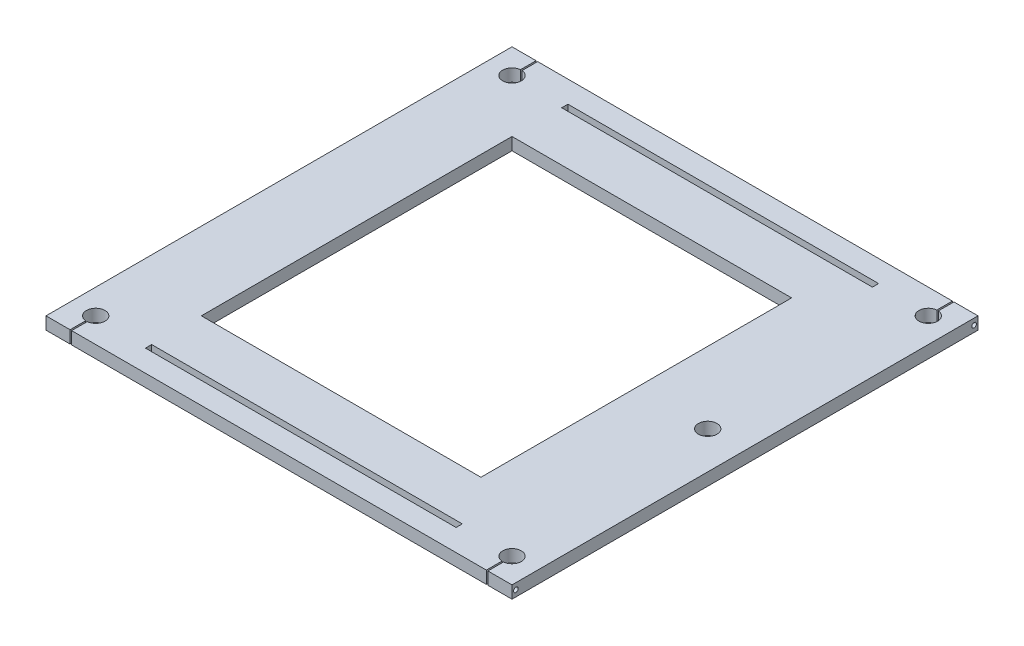
from build123d import *

# Parameters (mm, degrees)
SKETCH1_W               = 300
SKETCH1_H               = 300
SKETCH1_W_2             = 180
SKETCH1_H_2             = 200
BOSS_EXTRUDE1_DEPTH     = 8
CUT_EXTRUDE1_DEPTH      = 213.282830205
SKETCH3_R               = 1.5
CUT_EXTRUDE2_DEPTH      = 16.5
SKETCH4_R               = 6
CUT_EXTRUDE4_DEPTH      = 213.282830205
MIRROR4_COPY_1_DEPTH    = 213.282830205
MIRROR4_COPY_2_SKETCH_R = 1.5
MIRROR4_COPY_2_DEPTH    = 16.5
SKETCH5_W               = 200
SKETCH5_H               = 4
CUT_EXTRUDE5_DEPTH      = 213.282830205


with BuildPart() as part:
    # Sketch1 → Boss-Extrude1 (new body)
    with BuildSketch(Plane(origin=(0, 0, 0), x_dir=(1, 0, 0), z_dir=(0, 1, 0))):
        Rectangle(SKETCH1_W, SKETCH1_H)
        with Locations((-10, 0)):
            Rectangle(SKETCH1_W_2, SKETCH1_H_2, mode=Mode.SUBTRACT)
    extrude(amount=BOSS_EXTRUDE1_DEPTH)

    # Sketch2 → Cut-Extrude1 (cut, through all)
    with BuildSketch(Plane(origin=(0, 0, 0), x_dir=(1, 0, 0), z_dir=(0, 1, 0))):
        with BuildLine():
            Line((133.5, 150), (134.5, 150))
            Line((134.5, 150), (134.5, 139.979130372))
            ThreePointArc((134.5, 139.979130372), (134, 128), (133.5, 139.979130372))
            Line((133.5, 139.979130372), (133.5, 150))
        make_face()
    cut_extrude1 = extrude(amount=CUT_EXTRUDE1_DEPTH, mode=Mode.SUBTRACT)

    # Sketch3 → Cut-Extrude2 (cut)
    with BuildSketch(Plane(origin=(150, 0, 0), x_dir=(0, 0, -1), z_dir=(1, 0, 0))):
        with Locations((147.5, 4)):
            Circle(SKETCH3_R)
    cut_extrude2 = extrude(amount=-CUT_EXTRUDE2_DEPTH, mode=Mode.SUBTRACT)

    # Mirror3: Cut-Extrude1, Cut-Extrude2 across plane
    add(cut_extrude1.mirror(Plane.XY), mode=Mode.SUBTRACT)
    add(cut_extrude2.mirror(Plane.XY), mode=Mode.SUBTRACT)

    # Sketch4 → Cut-Extrude4 (cut, through all)
    with BuildSketch(Plane(origin=(0, 0, 0), x_dir=(1, 0, 0), z_dir=(0, 1, 0))):
        with Locations(Location((126, 0, 0), (0, 0, 270))):
            Circle(SKETCH4_R)
    extrude(amount=CUT_EXTRUDE4_DEPTH, mode=Mode.SUBTRACT)

    # Mirror4: Cut-Extrude1, Cut-Extrude2 across plane
    add(cut_extrude1.mirror(Plane(origin=(0, 0, 0), x_dir=(0, 0, 1), z_dir=(1, 0, 0))), mode=Mode.SUBTRACT)
    add(cut_extrude2.mirror(Plane(origin=(0, 0, 0), x_dir=(0, 0, 1), z_dir=(1, 0, 0))), mode=Mode.SUBTRACT)

    # Mirror4 copy 1 sketch → Mirror4 copy 1 (cut, through all)
    with BuildSketch(Plane(origin=(0, 0, 0), x_dir=(-1, 0, 0), z_dir=(0, 1, 0))):
        with BuildLine():
            Line((133.5, 150), (134.5, 150))
            Line((134.5, 150), (134.5, 139.979130372))
            ThreePointArc((134.5, 139.979130372), (134, 128), (133.5, 139.979130372))
            Line((133.5, 139.979130372), (133.5, 150))
        make_face()
    extrude(amount=MIRROR4_COPY_1_DEPTH, mode=Mode.SUBTRACT)

    # Mirror4 copy 2 sketch → Mirror4 copy 2 (cut)
    with BuildSketch(Plane.ZY.offset(150)):
        with Locations((147.5, 4)):
            Circle(MIRROR4_COPY_2_SKETCH_R)
    extrude(amount=-MIRROR4_COPY_2_DEPTH, mode=Mode.SUBTRACT)

    # Sketch5 → Cut-Extrude5 (cut, through all)
    with BuildSketch(Plane(origin=(0, 0, 0), x_dir=(1, 0, 0), z_dir=(0, 1, 0))):
        with Locations((0, 134)):
            Rectangle(SKETCH5_W, SKETCH5_H)
    cut_extrude5 = extrude(amount=CUT_EXTRUDE5_DEPTH, mode=Mode.SUBTRACT)

    # Mirror5: Cut-Extrude5 across plane
    add(cut_extrude5.mirror(Plane.XY), mode=Mode.SUBTRACT)


solid = part.part
